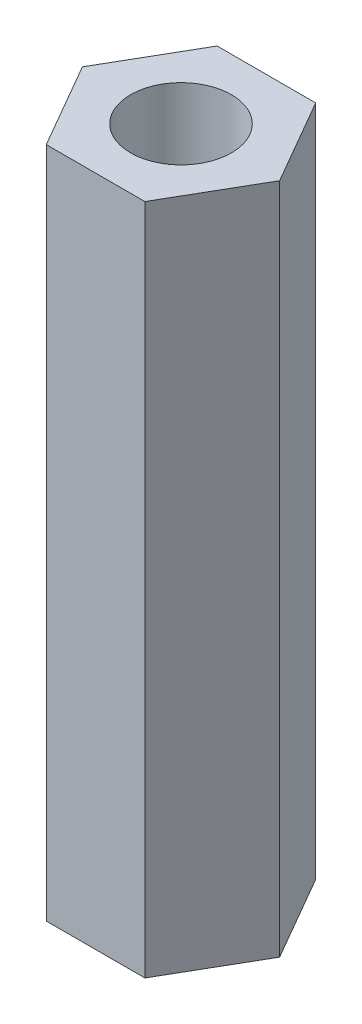
from build123d import *

# Parameters (mm, degrees)
SKETCH1_R           = 1.5
BOSS_EXTRUDE1_DEPTH = 20


with BuildPart() as part:
    # Sketch1 → Boss-Extrude1 (new body)
    with BuildSketch(Plane(origin=(0, 0, 0), x_dir=(1, 0, 0), z_dir=(0, 1, 0))):
        Polygon((1.466469684, 2.54), (-1.466469684, 2.54), (-2.932939367, 0), (-1.466469684, -2.54), (1.466469684, -2.54), (2.932939367, 0), align=None)
        with Locations(Location((0, 0, 0), (0, 0, 270))):
            Circle(SKETCH1_R, mode=Mode.SUBTRACT)
    extrude(amount=BOSS_EXTRUDE1_DEPTH)


solid = part.part
